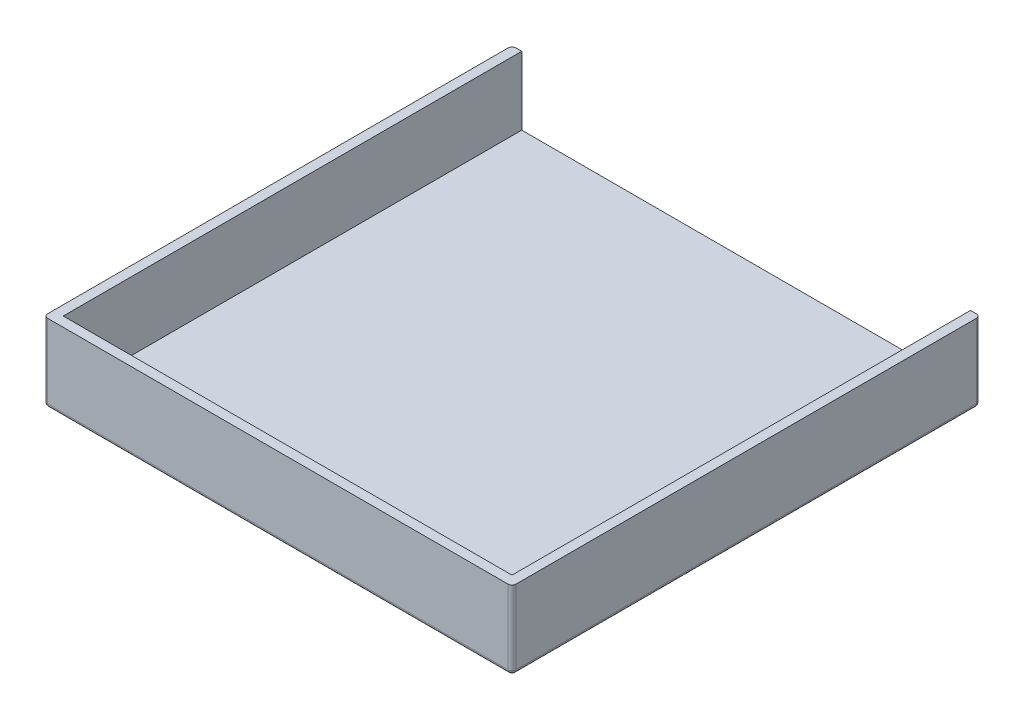
from build123d import *

# Parameters (mm, degrees)
SKETCH1_W           = 304.8
SKETCH1_H           = 304.8
BOSS_EXTRUDE1_DEPTH = 50.8
SHELL1_T            = -6.35
FILLET1_R           = 2.54


with BuildPart() as part:
    # Sketch1 → Boss-Extrude1 (new body)
    with BuildSketch(Plane(origin=(0, 0, 0), x_dir=(1, 0, 0), z_dir=(0, 1, 0))):
        with Locations((152.4, 152.4)):
            Rectangle(SKETCH1_W, SKETCH1_H)
    extrude(amount=BOSS_EXTRUDE1_DEPTH)

    # Shell1
    shell1_openings = [part.faces().sort_by_distance(p)[0] for p in [
        (152.4, 50.8, -152.4),
        (152.4, 25.4, -304.8),
    ]]
    offset(amount=SHELL1_T, openings=shell1_openings, kind=Kind.INTERSECTION)

    # Fillet1
    fillet1_edges = [part.edges().sort_by_distance(p)[0] for p in [
        (152.4, 0, -304.8),
        (304.8, 0, -152.4),
        (152.4, 0, 0),
        (0, 0, -152.4),
        (0, 25.4, -304.8),
        (304.8, 25.4, -304.8),
        (304.8, 25.4, 0),
        (0, 25.4, 0),
    ]]
    fillet(fillet1_edges, radius=FILLET1_R)


solid = part.part
